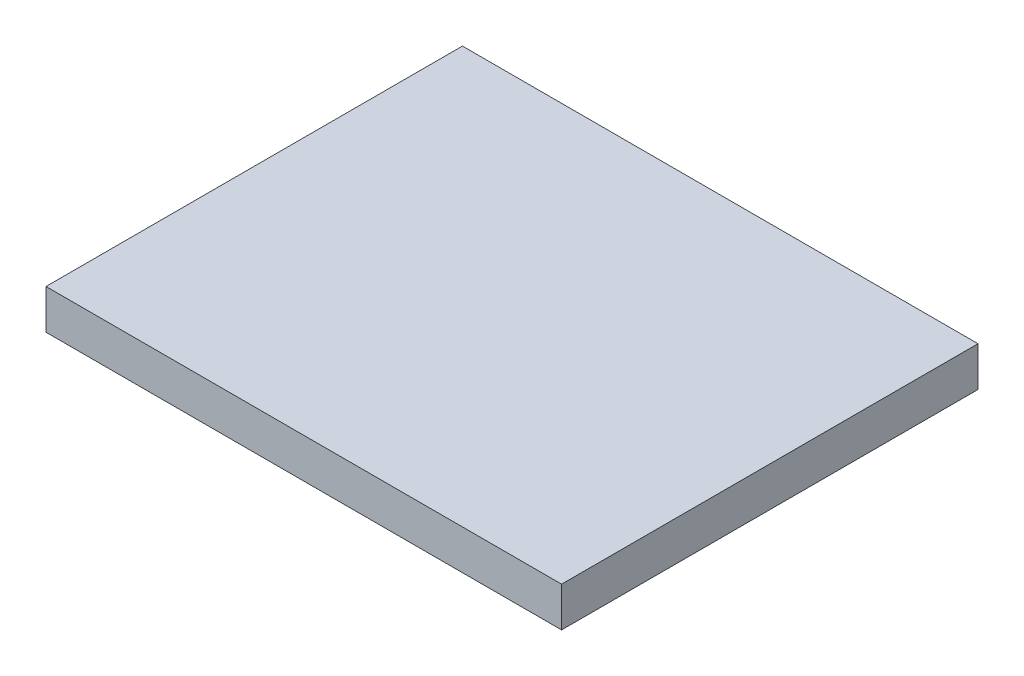
from build123d import *

# Parameters (mm, degrees)
SKETCH2_W           = 1300
SKETCH2_H           = 1050
BOSS_EXTRUDE1_DEPTH = 100


with BuildPart() as part:
    # Sketch2 → Boss-Extrude1 (new body)
    with BuildSketch(Plane(origin=(0, 0, 0), x_dir=(1, 0, 0), z_dir=(0, 1, 0))):
        Rectangle(SKETCH2_W, SKETCH2_H)
    extrude(amount=BOSS_EXTRUDE1_DEPTH)


solid = part.part
